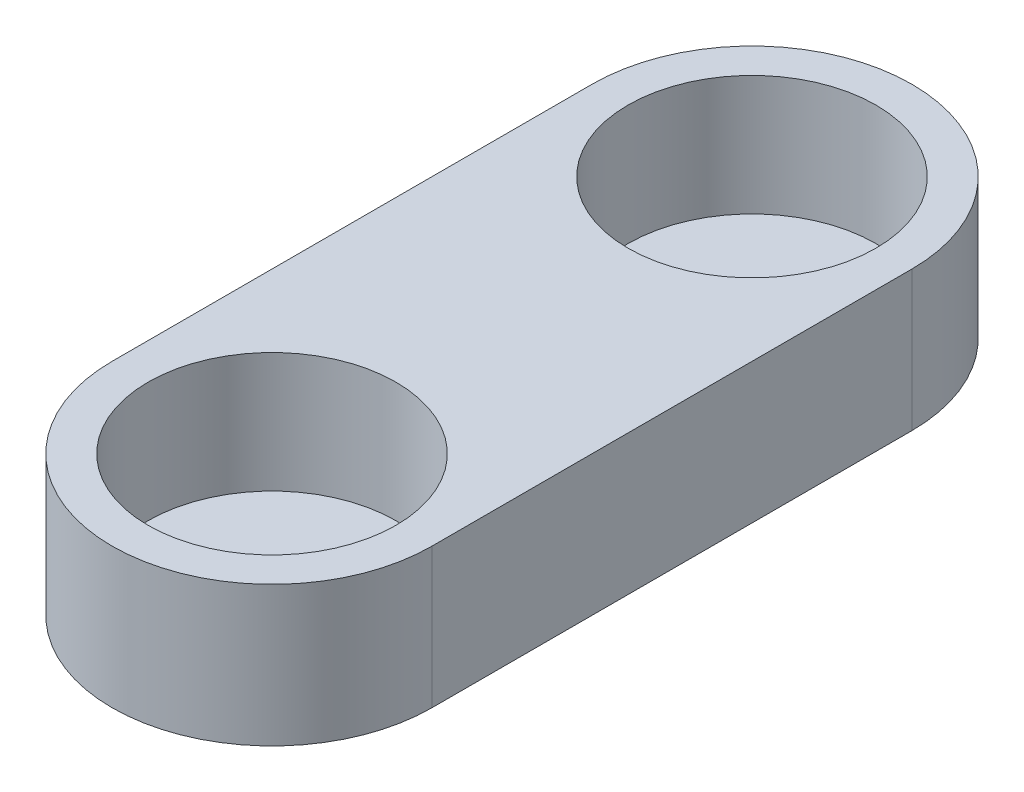
from build123d import *

# Parameters (mm, degrees)
SKETCH1_R           = 3.1
BOSS_EXTRUDE1_DEPTH = 3
BOSS_EXTRUDE2_START = 0.5
BOSS_EXTRUDE2_DEPTH = 0.5
SKETCH3_R           = 0.85
CUT_EXTRUDE1_DEPTH  = 2.5
SKETCH4_R           = 1
CUT_EXTRUDE2_DEPTH  = 12.324751653


with BuildPart() as part:
    # Sketch1 → Boss-Extrude1 (new body)
    with BuildSketch(Plane(origin=(0, 0, 0), x_dir=(1, 0, 0), z_dir=(0, 1, 0))):
        with BuildLine():
            Line((4, 6), (4, -6))
            ThreePointArc((4, -6), (0, -10), (-4, -6))
            Line((-4, -6), (-4, 6))
            ThreePointArc((-4, 6), (0, 10), (4, 6))
        make_face()
        with Locations(Location((0, 6, 0), (0, 0, 270))):
            Circle(SKETCH1_R, mode=Mode.SUBTRACT)
        with Locations(Location((0, -6, 0), (0, 0, 270))):
            Circle(SKETCH1_R, mode=Mode.SUBTRACT)
    extrude(amount=BOSS_EXTRUDE1_DEPTH)

    # Sketch2 → Boss-Extrude2 (add)
    with BuildSketch(Plane.XZ.offset(BOSS_EXTRUDE2_START)):
        with BuildLine():
            Line((4, 6), (4, -6))
            ThreePointArc((4, -6), (0, -10), (-4, -6))
            Line((-4, -6), (-4, 6))
            ThreePointArc((-4, 6), (0, 10), (4, 6))
        make_face()
    extrude(amount=-BOSS_EXTRUDE2_DEPTH)

    # Sketch3 → Cut-Extrude1 (cut)
    with BuildSketch(Plane.XZ.offset(0.5)):
        with Locations(Location((0, 0, 0), (0, 0, 270))):
            Circle(SKETCH3_R)
    extrude(amount=-CUT_EXTRUDE1_DEPTH, mode=Mode.SUBTRACT)

    # Sketch4 → Cut-Extrude2 (cut, through all)
    with BuildSketch(Plane.XZ.offset(0.5)):
        with Locations(Location((0, 6, 0), (0, 0, 270))):
            Circle(SKETCH4_R)
        with Locations(Location((0, -6, 0), (0, 0, 270))):
            Circle(SKETCH4_R)
    extrude(amount=-CUT_EXTRUDE2_DEPTH, mode=Mode.SUBTRACT)


solid = part.part
